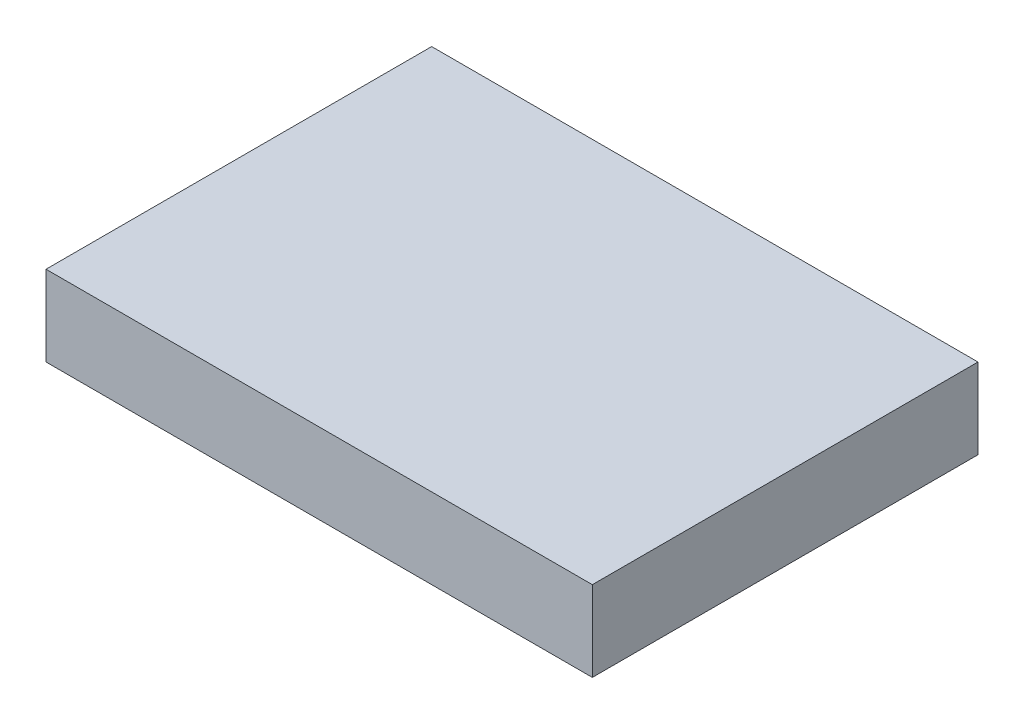
from build123d import *

# Parameters (mm, degrees)
ESBO_O1_W                = 34
ESBO_O1_H                = 24
RESSALTO_EXTRUS_O1_DEPTH = 5


with BuildPart() as part:
    # Esboço1 → Ressalto-extrusão1 (new body)
    with BuildSketch(Plane(origin=(0, 0, 0), x_dir=(1, 0, 0), z_dir=(0, 1, 0))):
        Rectangle(ESBO_O1_W, ESBO_O1_H)
    extrude(amount=RESSALTO_EXTRUS_O1_DEPTH)


solid = part.part
